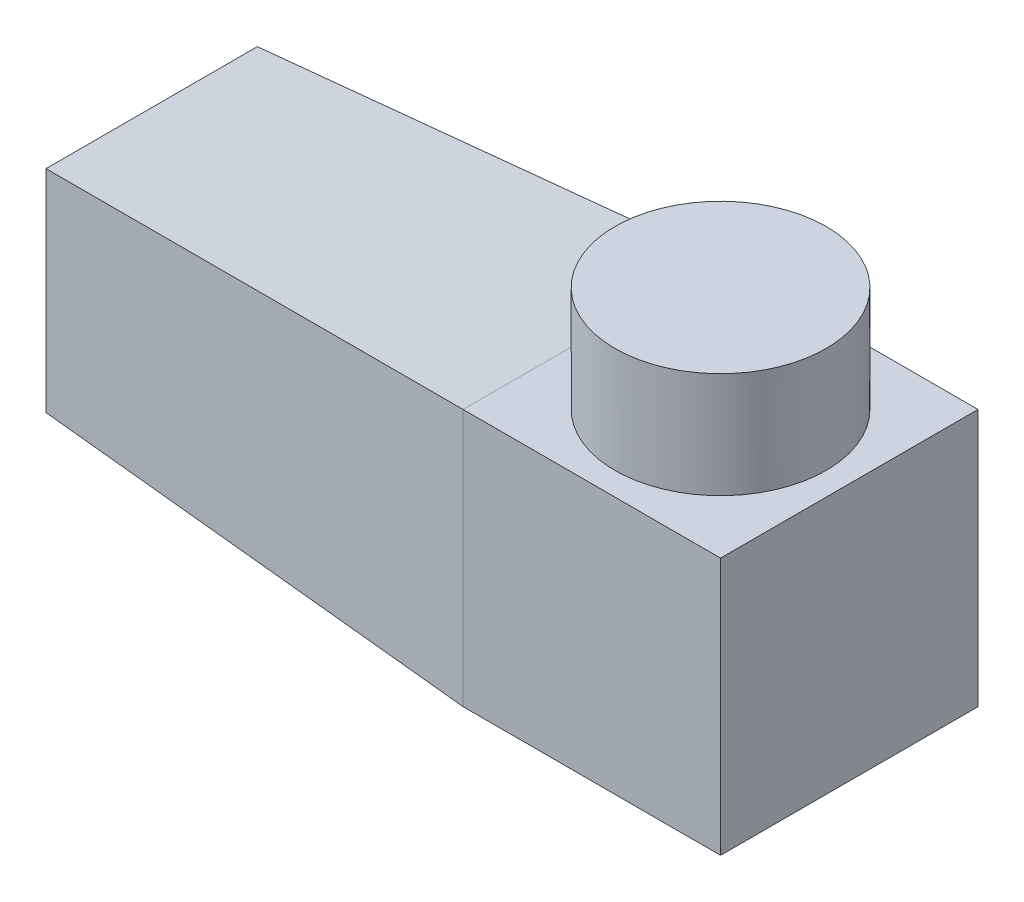
from build123d import *

# Parameters (mm, degrees)
SKETCH1_W           = 120
SKETCH1_H           = 120
BOSS_EXTRUDE1_DEPTH = 250
BOSS_EXTRUDE1_DRAFT = -3
SKETCH2_W           = 146.203889642
SKETCH2_H           = 146.203889642
BOSS_EXTRUDE2_DEPTH = 146.2
SKETCH3_R           = 60
BOSS_EXTRUDE3_DEPTH = 60


with BuildPart() as part:
    # Sketch1 → Boss-Extrude1 (with draft: the straight prism first)
    with BuildSketch(Plane(origin=(0, 0, 0), x_dir=(0, 0, -1), z_dir=(1, 0, 0))):
        Rectangle(SKETCH1_W, SKETCH1_H)
    extrude(amount=BOSS_EXTRUDE1_DEPTH)
    # Boss-Extrude1: the draft: its side faces are tilted about the plane it starts from
    boss_extrude1_sides = [part.faces().sort_by_distance(p)[0] for p in [
        (125, 0, 60),
        (125, -60, 0),
        (125, 0, -60),
        (125, 60, 0),
    ]]
    draft(boss_extrude1_sides, Plane(origin=(0, 0, 0), x_dir=(0, 0, -1), z_dir=(1, 0, 0)), BOSS_EXTRUDE1_DRAFT)

    # Sketch2 → Boss-Extrude2 (add)
    with BuildSketch(Plane(origin=(250, 0, 0), x_dir=(0, 0, -1), z_dir=(1, 0, 0))):
        Rectangle(SKETCH2_W, SKETCH2_H)
    extrude(amount=BOSS_EXTRUDE2_DEPTH)

    # Sketch3 → Boss-Extrude3 (add)
    with BuildSketch(Plane(origin=(0, 73.101944821, 0), x_dir=(1, 0, 0), z_dir=(0, 1, 0))):
        with Locations(Location((323.1, 0, 0), (0, 0, 90))):
            Circle(SKETCH3_R)
    extrude(amount=BOSS_EXTRUDE3_DEPTH)


solid = part.part
